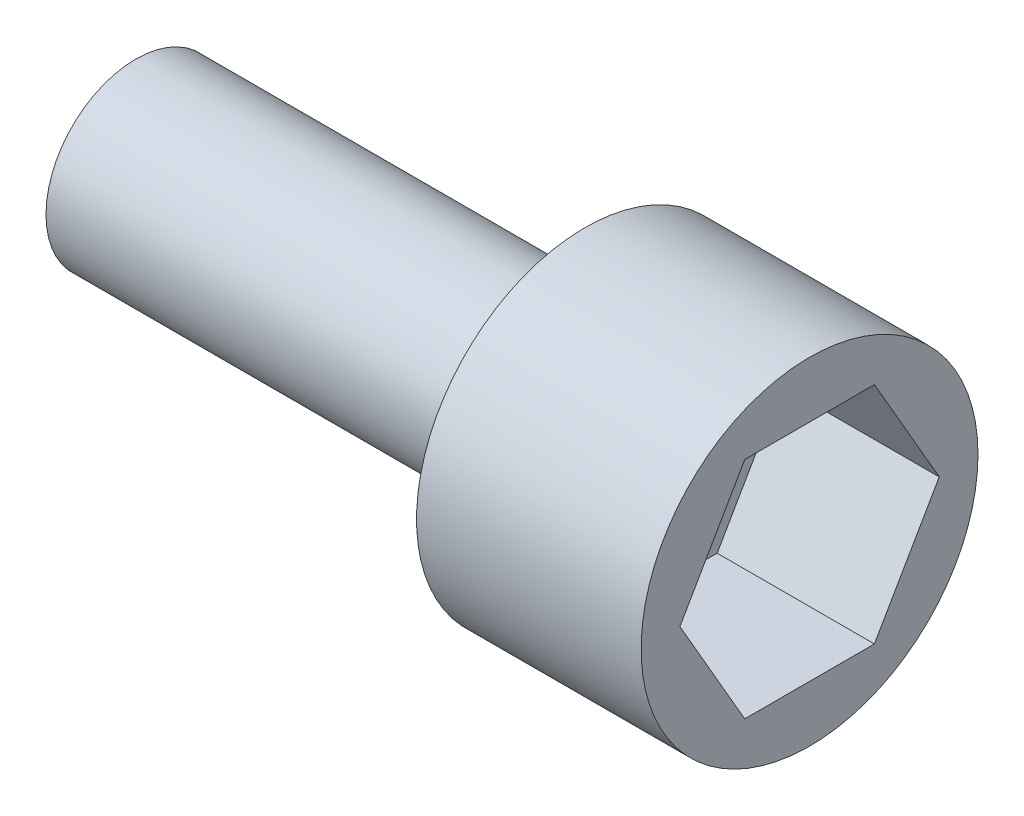
from build123d import *

# Parameters (mm, degrees)
CUT_EXTRUDE1_DEPTH = 7


with BuildPart() as part:
    # Sketch1 → Revolve1 (revolve)
    with BuildSketch(Plane.XY, mode=Mode.PRIVATE) as revolve1_sk:
        Polygon((0, 0), (0, 4), (20, 4), (20, 7.5), (30, 7.5), (30, 0), align=None)
    revolve(revolve1_sk.sketch.rotate(Axis((30, 0, 0), (-1, 0, 0)), 90), axis=Axis((30, 0, 0), (-1, 0, 0)))

    # Sketch2 → Cut-Extrude1 (cut)
    with BuildSketch(Plane(origin=(30, 0, 0), x_dir=(0, 0, -1), z_dir=(1, 0, 0))):
        Polygon((5.773502692, 0), (2.886751346, 5), (-2.886751346, 5), (-5.773502692, 0), (-2.886751346, -5), (2.886751346, -5), align=None)
    extrude(amount=-CUT_EXTRUDE1_DEPTH, mode=Mode.SUBTRACT)


solid = part.part
